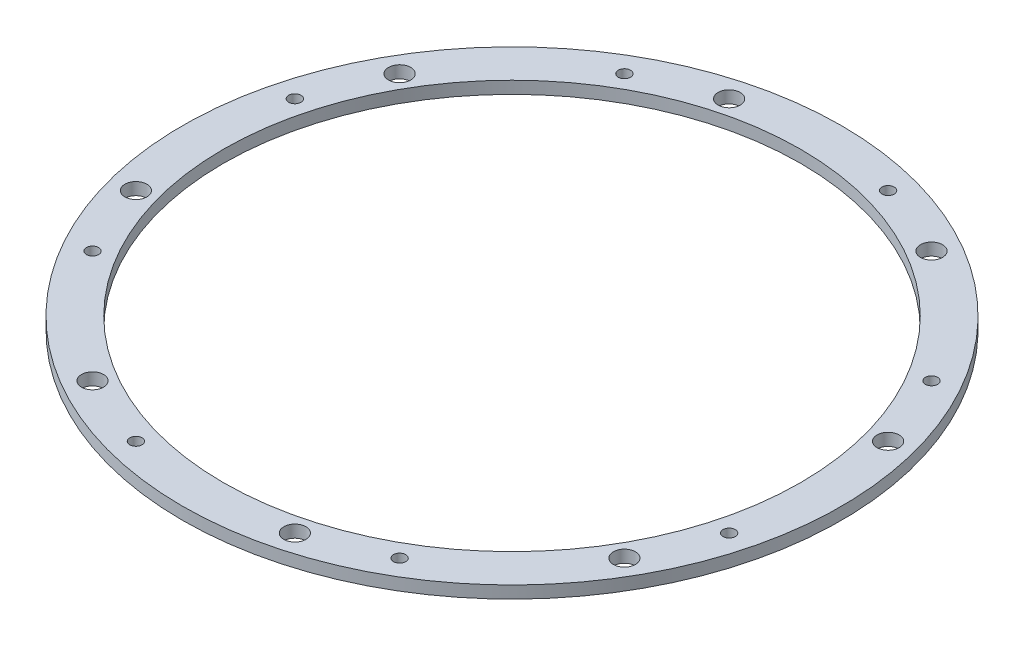
from build123d import *

# Parameters (mm, degrees)
SKETCH1_R           = 107.5
SKETCH1_R_2         = 94.17
SKETCH1_R_3         = 2
BOSS_EXTRUDE1_DEPTH = 4
SKETCH2_R           = 3.6
CUT_EXTRUDE1_DEPTH  = 10


with BuildPart() as part:
    # Sketch1 → Boss-Extrude1 (new body)
    with BuildSketch(Plane(origin=(0, 0, 0), x_dir=(1, 0, 0), z_dir=(0, 1, 0))):
        with Locations(Location((0, 0, 0), (0, 0, 270))):
            Circle(SKETCH1_R)
        with Locations(Location((0, 0, 0), (0, 0, 270))):
            Circle(SKETCH1_R_2, mode=Mode.SUBTRACT)
        with Locations(Location((86.749764697, 50.085, 0), (0, 0, 270))):
            Circle(SKETCH1_R_3, mode=Mode.SUBTRACT)
        with Locations(Location((96.756790019, -25.925903748, 0), (0, 0, 270))):
            Circle(SKETCH1_R_3, mode=Mode.SUBTRACT)
        with Locations(Location((50.085, -86.749764697, 0), (0, 0, 270))):
            Circle(SKETCH1_R_3, mode=Mode.SUBTRACT)
        with Locations(Location((-25.925903748, -96.756790019, 0), (0, 0, 270))):
            Circle(SKETCH1_R_3, mode=Mode.SUBTRACT)
        with Locations(Location((-86.749764697, -50.085, 0), (0, 0, 270))):
            Circle(SKETCH1_R_3, mode=Mode.SUBTRACT)
        with Locations(Location((-96.756790019, 25.925903748, 0), (0, 0, 270))):
            Circle(SKETCH1_R_3, mode=Mode.SUBTRACT)
        with Locations(Location((-50.085, 86.749764697, 0), (0, 0, 270))):
            Circle(SKETCH1_R_3, mode=Mode.SUBTRACT)
        with Locations(Location((25.925903748, 96.756790019, 0), (0, 0, 270))):
            Circle(SKETCH1_R_3, mode=Mode.SUBTRACT)
    extrude(amount=BOSS_EXTRUDE1_DEPTH)

    # Sketch2 → Cut-Extrude1 (cut)
    with BuildSketch(Plane(origin=(0, 4, 0), x_dir=(1, 0, 0), z_dir=(0, 1, 0))):
        with Locations(Location((96.756790019, 25.925903748, 0), (0, 0, 270))):
            Circle(SKETCH2_R)
        with Locations(Location((86.749764697, -50.085, 0), (0, 0, 270))):
            Circle(SKETCH2_R)
        with Locations(Location((25.925903748, -96.756790019, 0), (0, 0, 270))):
            Circle(SKETCH2_R)
        with Locations(Location((-50.085, -86.749764697, 0), (0, 0, 270))):
            Circle(SKETCH2_R)
        with Locations(Location((-96.756790019, -25.925903748, 0), (0, 0, 270))):
            Circle(SKETCH2_R)
        with Locations(Location((-86.749764697, 50.085, 0), (0, 0, 270))):
            Circle(SKETCH2_R)
        with Locations(Location((-25.925903748, 96.756790019, 0), (0, 0, 270))):
            Circle(SKETCH2_R)
        with Locations(Location((50.085, 86.749764697, 0), (0, 0, 270))):
            Circle(SKETCH2_R)
    extrude(amount=-CUT_EXTRUDE1_DEPTH, mode=Mode.SUBTRACT)


solid = part.part
